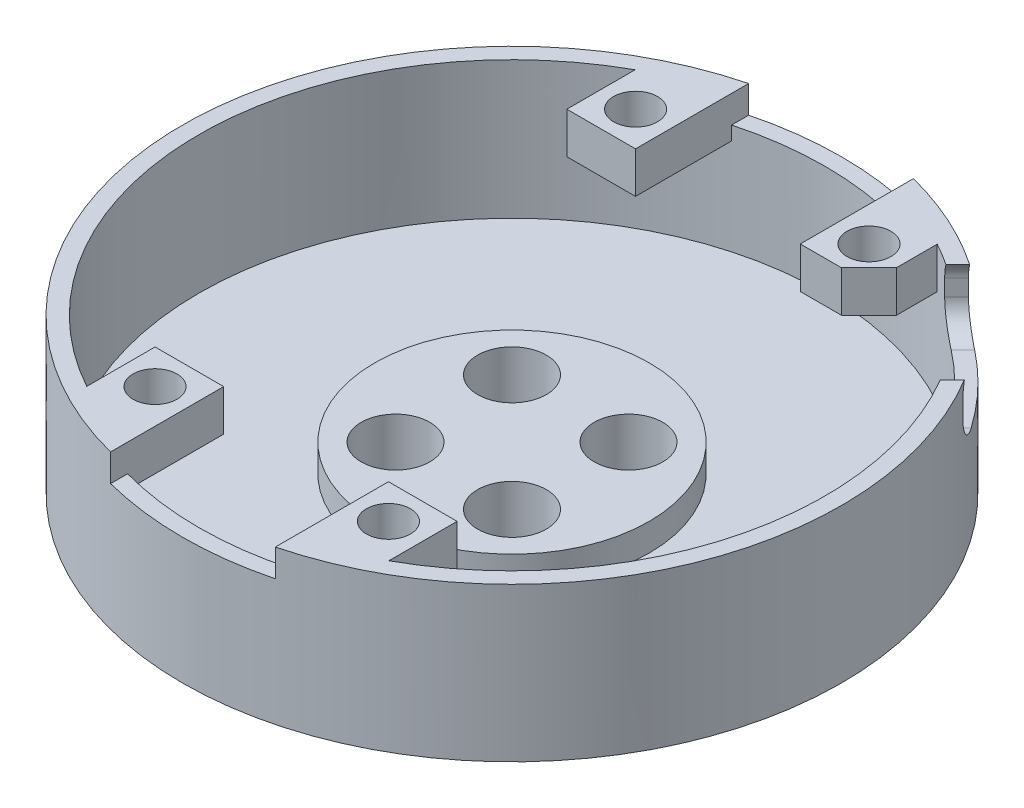
from build123d import *

# Parameters (mm, degrees)
SKETCH1_R           = 9
SKETCH1_R_2         = 1.2
BOSS_EXTRUDE1_DEPTH = 5
SKETCH2_R           = 24
BOSS_EXTRUDE2_DEPTH = 1.2
SKETCH4_R           = 1.2
CUT_EXTRUDE1_DEPTH  = 35.307433597
SKETCH5_R           = 10
SKETCH5_R_2         = 1.2
BOSS_EXTRUDE4_DEPTH = 2
SKETCH6_R           = 24
SKETCH6_R_2         = 22.8
BOSS_EXTRUDE5_DEPTH = 10
SKETCH7_W           = 12
SKETCH7_H           = 48
CUT_EXTRUDE2_DEPTH  = 2
BOSS_EXTRUDE6_START = -3
SKETCH9_R           = 1.6
BOSS_EXTRUDE6_DEPTH = 3
SKETCH10_R          = 2.5
CUT_EXTRUDE3_DEPTH  = 7
BOSS_EXTRUDE7_START = -1
SKETCH1_2_R         = 9
SKETCH1_2_R_2       = 1.2
BOSS_EXTRUDE7_DEPTH = 1
CUT_EXTRUDE4_DEPTH  = 5
SKETCH18_OUTSIDE_W  = 64.006
SKETCH18_OUTSIDE_H  = 64.006
SKETCH18_OUTSIDE_R  = 24
CUT_EXTRUDE5_DEPTH  = 5


with BuildPart() as part:
    # Sketch1 → Boss-Extrude1 (new body)
    with BuildSketch(Plane(origin=(0, 0, 0), x_dir=(1, 0, 0), z_dir=(0, 1, 0))):
        Circle(SKETCH1_R)
        with Locations((4.242640687, 4.242640687)):
            Circle(SKETCH1_R_2, mode=Mode.SUBTRACT)
        with Locations((-4.242640687, 4.242640687)):
            Circle(SKETCH1_R_2, mode=Mode.SUBTRACT)
        with Locations((4.242640687, -4.242640687)):
            Circle(SKETCH1_R_2, mode=Mode.SUBTRACT)
        with Locations((-4.242640687, -4.242640687)):
            Circle(SKETCH1_R_2, mode=Mode.SUBTRACT)
    extrude(amount=BOSS_EXTRUDE1_DEPTH)

    # Sketch2 → Boss-Extrude2 (add)
    with BuildSketch(Plane(origin=(0, 5, 0), x_dir=(1, 0, 0), z_dir=(0, 1, 0))):
        Circle(SKETCH2_R)
    extrude(amount=BOSS_EXTRUDE2_DEPTH)

    # Sketch4 → Cut-Extrude1 (cut, through all)
    with BuildSketch(Plane.XZ.offset(-5)):
        with Locations((-4.242640687, -4.242640687)):
            Circle(SKETCH4_R)
        with Locations((4.242640687, -4.242640687)):
            Circle(SKETCH4_R)
        with Locations((4.242640687, 4.242640687)):
            Circle(SKETCH4_R)
        with Locations((-4.242640687, 4.242640687)):
            Circle(SKETCH4_R)
    extrude(amount=-CUT_EXTRUDE1_DEPTH, mode=Mode.SUBTRACT)

    # Sketch5 → Boss-Extrude4 (add)
    with BuildSketch(Plane(origin=(0, 6.2, 0), x_dir=(1, 0, 0), z_dir=(0, 1, 0))):
        Circle(SKETCH5_R)
        with Locations((4.242640687, -4.242640687)):
            Circle(SKETCH5_R_2, mode=Mode.SUBTRACT)
        with Locations((-4.242640687, -4.242640687)):
            Circle(SKETCH5_R_2, mode=Mode.SUBTRACT)
        with Locations((-4.242640687, 4.242640687)):
            Circle(SKETCH5_R_2, mode=Mode.SUBTRACT)
        with Locations((4.242640687, 4.242640687)):
            Circle(SKETCH5_R_2, mode=Mode.SUBTRACT)
    extrude(amount=BOSS_EXTRUDE4_DEPTH)

    # Sketch6 → Boss-Extrude5 (add)
    with BuildSketch(Plane(origin=(0, 6.2, 0), x_dir=(1, 0, 0), z_dir=(0, 1, 0))):
        Circle(SKETCH6_R)
        Circle(SKETCH6_R_2, mode=Mode.SUBTRACT)
    extrude(amount=BOSS_EXTRUDE5_DEPTH)

    # Sketch7 → Cut-Extrude2 (cut)
    with BuildSketch(Plane(origin=(0, 16.2, 0), x_dir=(1, 0, 0), z_dir=(0, 1, 0))):
        Rectangle(SKETCH7_W, SKETCH7_H)
    extrude(amount=-CUT_EXTRUDE2_DEPTH, mode=Mode.SUBTRACT)

    # Sketch9 → Boss-Extrude6 (add)
    # profile 1 of 4: a face of its own
    with BuildSketch(Plane(origin=(0, 16.2, 0), x_dir=(1, 0, 0), z_dir=(0, 1, 0)).offset(BOSS_EXTRUDE6_START)):
        with BuildLine():
            Line((-6, 14.996363336), (-6, 21.996363336))
            ThreePointArc((-6, 21.996363336), (-8.560113637, 21.132071704), (-11, 19.970978944))
            Line((-11, 19.970978944), (-11, 14.996363336))
            Line((-11, 14.996363336), (-6, 14.996363336))
        make_face()
        with Locations((-8.5, 17.5)):
            Circle(SKETCH9_R, mode=Mode.SUBTRACT)
    # profile 2 of 4: a face of its own
    with BuildSketch(Plane(origin=(0, 16.2, 0), x_dir=(1, 0, 0), z_dir=(0, 1, 0)).offset(BOSS_EXTRUDE6_START)):
        with BuildLine():
            ThreePointArc((11, 19.970978944), (8.560113637, 21.132071704), (6, 21.996363336))
            Line((6, 21.996363336), (6, 14.996363336))
            Line((6, 14.996363336), (11, 14.996363336))
            Line((11, 14.996363336), (11, 19.970978944))
        make_face()
        with Locations((8.5, 17.5)):
            Circle(SKETCH9_R, mode=Mode.SUBTRACT)
    # profile 3 of 4: a face of its own
    with BuildSketch(Plane(origin=(0, 16.2, 0), x_dir=(1, 0, 0), z_dir=(0, 1, 0)).offset(BOSS_EXTRUDE6_START)):
        with BuildLine():
            Line((-11, -14.996363336), (-11, -19.970978944))
            ThreePointArc((-11, -19.970978944), (-8.560113637, -21.132071704), (-6, -21.996363336))
            Line((-6, -21.996363336), (-6, -14.996363336))
            Line((-6, -14.996363336), (-11, -14.996363336))
        make_face()
        with Locations((-8.5, -17.5)):
            Circle(SKETCH9_R, mode=Mode.SUBTRACT)
    # profile 4 of 4: a face of its own
    with BuildSketch(Plane(origin=(0, 16.2, 0), x_dir=(1, 0, 0), z_dir=(0, 1, 0)).offset(BOSS_EXTRUDE6_START)):
        with BuildLine():
            ThreePointArc((6, -21.996363336), (8.560113637, -21.132071704), (11, -19.970978944))
            Line((11, -19.970978944), (11, -14.996363336))
            Line((11, -14.996363336), (6, -14.996363336))
            Line((6, -14.996363336), (6, -21.996363336))
        make_face()
        with Locations((8.5, -17.5)):
            Circle(SKETCH9_R, mode=Mode.SUBTRACT)
    extrude(amount=BOSS_EXTRUDE6_DEPTH)

    # Sketch10 → Cut-Extrude3 (cut)
    with BuildSketch(Plane(origin=(0, 8.2, 0), x_dir=(1, 0, 0), z_dir=(0, 1, 0))):
        with Locations((4.242640687, 4.242640687)):
            Circle(SKETCH10_R)
        with Locations((4.242640687, -4.242640687)):
            Circle(SKETCH10_R)
        with Locations((-4.242640687, -4.242640687)):
            Circle(SKETCH10_R)
        with Locations((-4.242640687, 4.242640687)):
            Circle(SKETCH10_R)
    extrude(amount=-CUT_EXTRUDE3_DEPTH, mode=Mode.SUBTRACT)

    # Sketch1<2> → Boss-Extrude7 (add)
    with BuildSketch(Plane(origin=(0, 0, 0), x_dir=(1, 0, 0), z_dir=(0, 1, 0)).offset(BOSS_EXTRUDE7_START)):
        Circle(SKETCH1_2_R)
        with Locations((4.242640687, 4.242640687)):
            Circle(SKETCH1_2_R_2, mode=Mode.SUBTRACT)
        with Locations((-4.242640687, 4.242640687)):
            Circle(SKETCH1_2_R_2, mode=Mode.SUBTRACT)
        with Locations((4.242640687, -4.242640687)):
            Circle(SKETCH1_2_R_2, mode=Mode.SUBTRACT)
        with Locations((-4.242640687, -4.242640687)):
            Circle(SKETCH1_2_R_2, mode=Mode.SUBTRACT)
    extrude(amount=BOSS_EXTRUDE7_DEPTH)

    # Sketch15 → Cut-Extrude4 (cut)
    with BuildSketch(Plane(origin=(18.32105018, 1.602e-06, -18.32105018), x_dir=(-0.7071067811865515, 6.181721199999928e-08, -0.7071067811865409), z_dir=(0.7071067811865437, 6.181721199999997e-08, -0.7071067811865488))):
        with BuildLine():
            Line((-4.091985108, 11.979999846), (2.848014892, 11.979998988))
            ThreePointArc((2.848014892, 11.979998988), (4.241015323, 12.556998456), (4.818015136, 13.949998744))
            Line((4.818015136, 13.949998744), (4.818015284, 15.149998744))
            ThreePointArc((4.818015284, 15.149998744), (4.241015815, 16.542999174), (2.848015528, 17.119998988))
            Line((2.848015528, 17.119998988), (-4.091984472, 17.119999846))
            ThreePointArc((-4.091984472, 17.119999846), (-5.484984903, 16.543000377), (-6.061984716, 15.150000089))
            Line((-6.061984716, 15.150000089), (-6.061984864, 13.950000089))
            ThreePointArc((-6.061984864, 13.950000089), (-5.484985395, 12.556999659), (-4.091985108, 11.979999846))
        make_face()
    extrude(amount=-CUT_EXTRUDE4_DEPTH, mode=Mode.SUBTRACT)

    # Sketch18 outside → Cut-Extrude5 (cut)
    # profile 1 of 2: a face of its own
    with BuildSketch(Plane(origin=(0, 16.2, 0), x_dir=(1, 0, 0), z_dir=(0, 1, 0))):
        Rectangle(SKETCH18_OUTSIDE_W, SKETCH18_OUTSIDE_H)
        Circle(SKETCH18_OUTSIDE_R, mode=Mode.SUBTRACT)
    # profile 2 of 2: a face of its own
    with BuildSketch(Plane(origin=(0, 16.2, 0), x_dir=(1, 0, 0), z_dir=(0, 1, 0))):
        Polygon((11, 16.996363336), (9, 14.996363336), (11, 14.996363336), align=None)
    extrude(amount=-CUT_EXTRUDE5_DEPTH, mode=Mode.SUBTRACT)


solid = part.part
